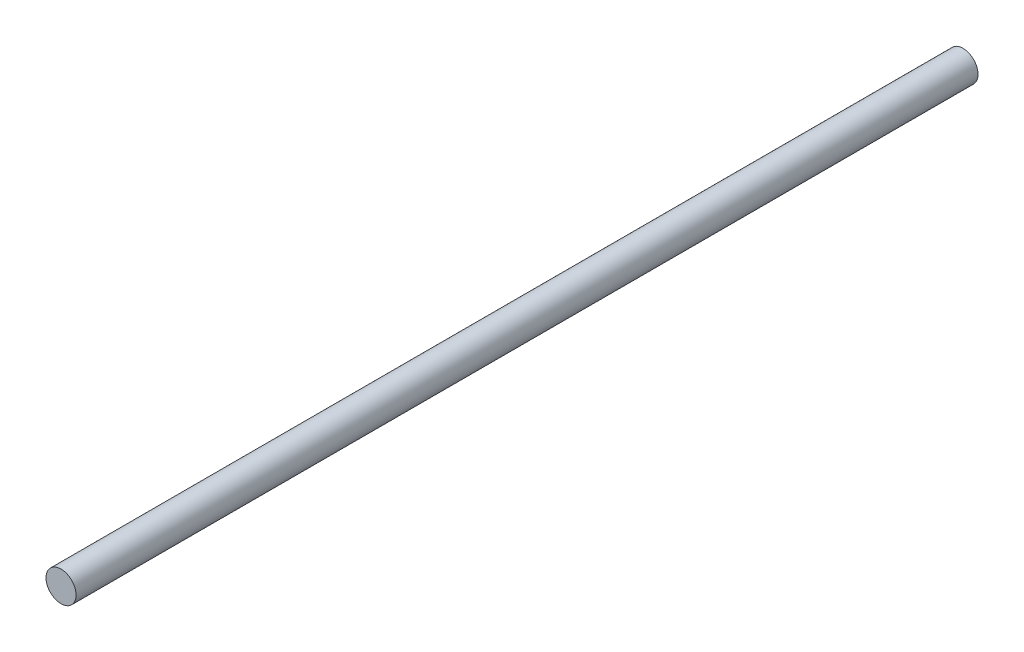
from build123d import *

# Parameters (mm, degrees)
CROQUIS1_R              = 1.5
SALIENTE_EXTRUIR1_DEPTH = 90


with BuildPart() as part:
    # Croquis1 → Saliente-Extruir1 (new body)
    with BuildSketch(Plane.XY):
        with Locations(Location((0, 0, 0), (0, 0, 180))):
            Circle(CROQUIS1_R)
    extrude(amount=SALIENTE_EXTRUIR1_DEPTH)


solid = part.part
